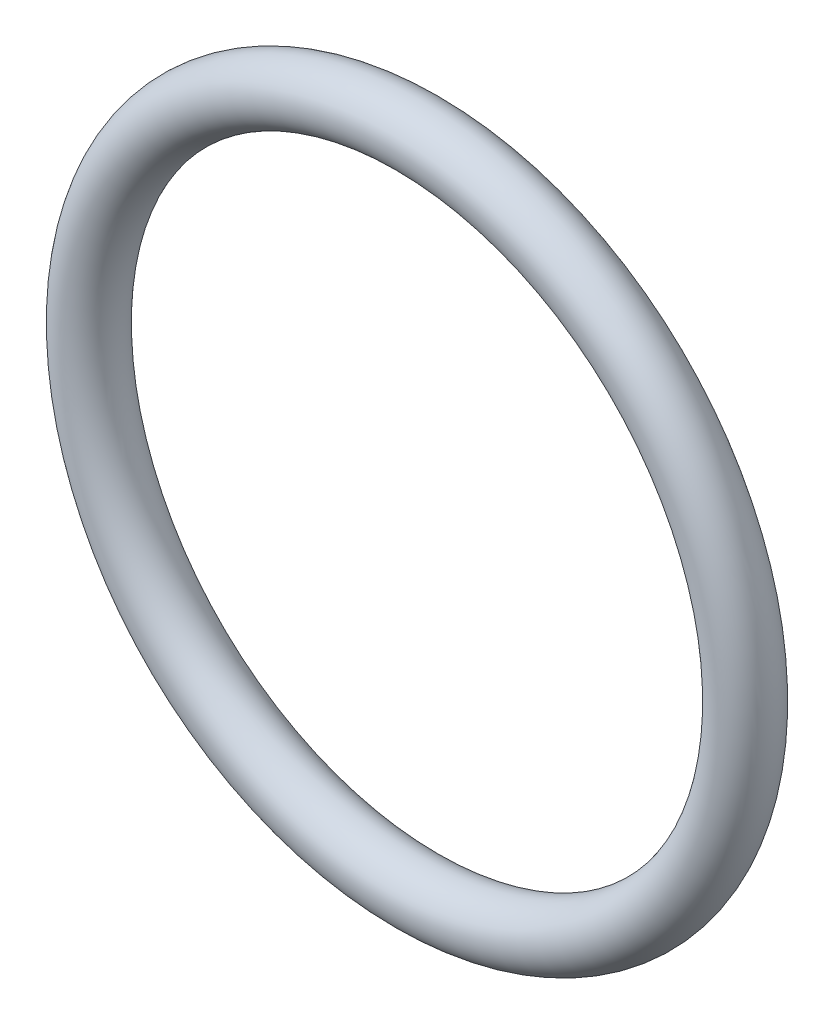
from build123d import *

# Parameters (mm, degrees)
SKETCH2_R = 3.4925


with BuildPart() as part:
    # Sketch2 → Revolve1 (revolve)
    with BuildSketch(Plane(origin=(0, 0, 0), x_dir=(0, 0, -1), z_dir=(1, 0, 0)), mode=Mode.PRIVATE) as revolve1_sk:
        with Locations((0, 38.1)):
            Circle(SKETCH2_R)
    revolve(revolve1_sk.sketch.rotate(Axis((0, 0, 34.6075), (0, 0, -1)), 180), axis=Axis((0, 0, 34.6075), (0, 0, -1)))


solid = part.part
